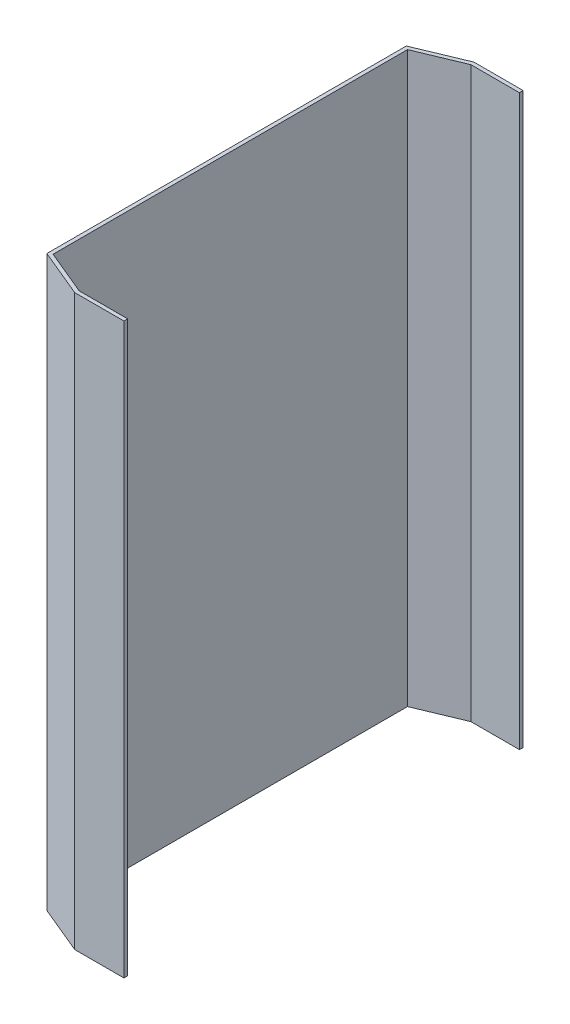
from build123d import *

# Parameters (mm, degrees)
BOSS_EXTRU_1_DEPTH = 305


with BuildPart() as part:
    # Esquisse1 → Boss.-Extru.1 (new body)
    with BuildSketch(Plane(origin=(0, 0, 0), x_dir=(1, 0, 0), z_dir=(0, 1, 0))):
        Polygon((0, 95), (0, -95), (24, -105), (50, -105), (50, -107), (23.6, -107), (-2, -96.333333333), (-2, 96.333333333), (23.6, 107), (50, 107), (50, 105), (24, 105), align=None)
    extrude(amount=BOSS_EXTRU_1_DEPTH)


solid = part.part
